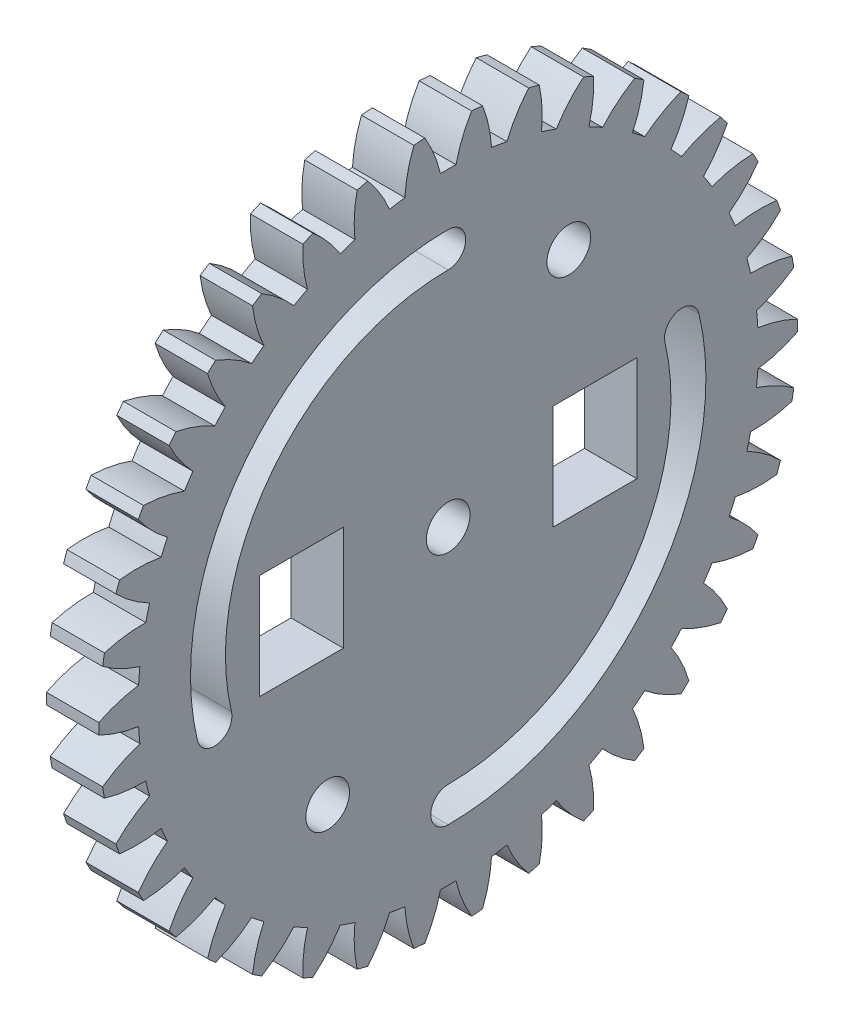
from build123d import *

# Parameters (mm, degrees)
BASPROSKE_W        = 6
BASPROSKE_H        = 40
TOOTHCUT_DEPTH     = 57.885850613
TEETHCUTS_COUNT    = 38
TEETHCUTS_ANGLE    = 350.526315789
BORSKE_R           = 2.5
BORE_DEPTH         = 50.0000508
SKETCH1_R          = 2.5
SKETCH1_W          = 9.6
SKETCH1_H          = 12
CUT_EXTRUDE1_DEPTH = 60


with BuildPart() as part:
    # BasProSke → Base-Revolve (revolve)
    with BuildSketch(Plane(origin=(0, 0, 0), x_dir=(1, 0, 0), z_dir=(0, 1, 0)), mode=Mode.PRIVATE) as base_revolve_sk:
        with Locations((3, 20)):
            Rectangle(BASPROSKE_W, BASPROSKE_H)
    revolve(base_revolve_sk.sketch.rotate(Axis((-10, 0, 0), (1, 0, 0)), 180), axis=Axis((-10, 0, 0), (1, 0, 0)))

    # TooCutSke → ToothCut (cut, through all)
    with BuildSketch(Plane(origin=(0, 0, 0), x_dir=(0, 0, -1), z_dir=(1, 0, 0))):
        with BuildLine():
            ThreePointArc((0.888554586, 35.487877814), (0, 35.499), (-0.888554586, 35.487877814))
            ThreePointArc((-0.888554586, 35.487877814), (-1.613438956, 37.782935975), (-2.691501587, 39.934802671))
            ThreePointArc((-2.691501587, 39.934802671), (0, 40.0254), (2.691501587, 39.934802671))
            ThreePointArc((2.691501587, 39.934802671), (1.613438956, 37.782935975), (0.888554586, 35.487877814))
        make_face()
    toothcut = extrude(amount=TOOTHCUT_DEPTH, mode=Mode.SUBTRACT)

    # TeethCuts: ToothCut ×38 about axis
    teethcuts_axis = Axis((-10, 0, 0), (1, 0, 0))
    for i in range(1, TEETHCUTS_COUNT):
        add(toothcut.rotate(teethcuts_axis, i * TEETHCUTS_ANGLE / (TEETHCUTS_COUNT - 1)), mode=Mode.SUBTRACT)

    # BorSke → Bore (cut, symmetric)
    with BuildSketch(Plane(origin=(0, 0, 0), x_dir=(0, 0, -1), z_dir=(1, 0, 0))):
        with Locations(Location((0, 0, 0), (0, 0, 180))):
            Circle(BORSKE_R)
    extrude(amount=BORE_DEPTH, both=True, mode=Mode.SUBTRACT)

    # Sketch1 → Cut-Extrude1 (cut)
    with BuildSketch(Plane(origin=(16, 0, 0), x_dir=(0, 0, -1), z_dir=(1, 0, 0))):
        with Locations(Location((0, 0, 0), (0, 0, 180))):
            Circle(SKETCH1_R)
        with Locations((-13.8, -20.6)):
            Circle(SKETCH1_R)
        with Locations((13.8, 20.6)):
            Circle(SKETCH1_R)
        with Locations((-16.8, 0)):
            Rectangle(SKETCH1_W, SKETCH1_H)
        with Locations((16.8, 0)):
            Rectangle(SKETCH1_W, SKETCH1_H)
        with BuildLine():
            ThreePointArc((0, 29.5), (-23.137254902, 18.300749591), (-28.707058182, -6.79373318))
            ThreePointArc((-28.707058182, -6.79373318), (-26.30022487, -8.279382332), (-24.814575717, -5.87254902))
            ThreePointArc((-24.814575717, -5.87254902), (-20, 15.81929202), (0, 25.5))
            ThreePointArc((0, 25.5), (2, 27.5), (0, 29.5))
        make_face()
        with BuildLine():
            ThreePointArc((0, -29.5), (23.137254902, -18.300749591), (28.707058182, 6.79373318))
            ThreePointArc((28.707058182, 6.79373318), (26.30022487, 8.279382332), (24.814575717, 5.87254902))
            ThreePointArc((24.814575717, 5.87254902), (20, -15.81929202), (0, -25.5))
            ThreePointArc((0, -25.5), (-2, -27.5), (0, -29.5))
        make_face()
    extrude(amount=-CUT_EXTRUDE1_DEPTH, mode=Mode.SUBTRACT)


solid = part.part
